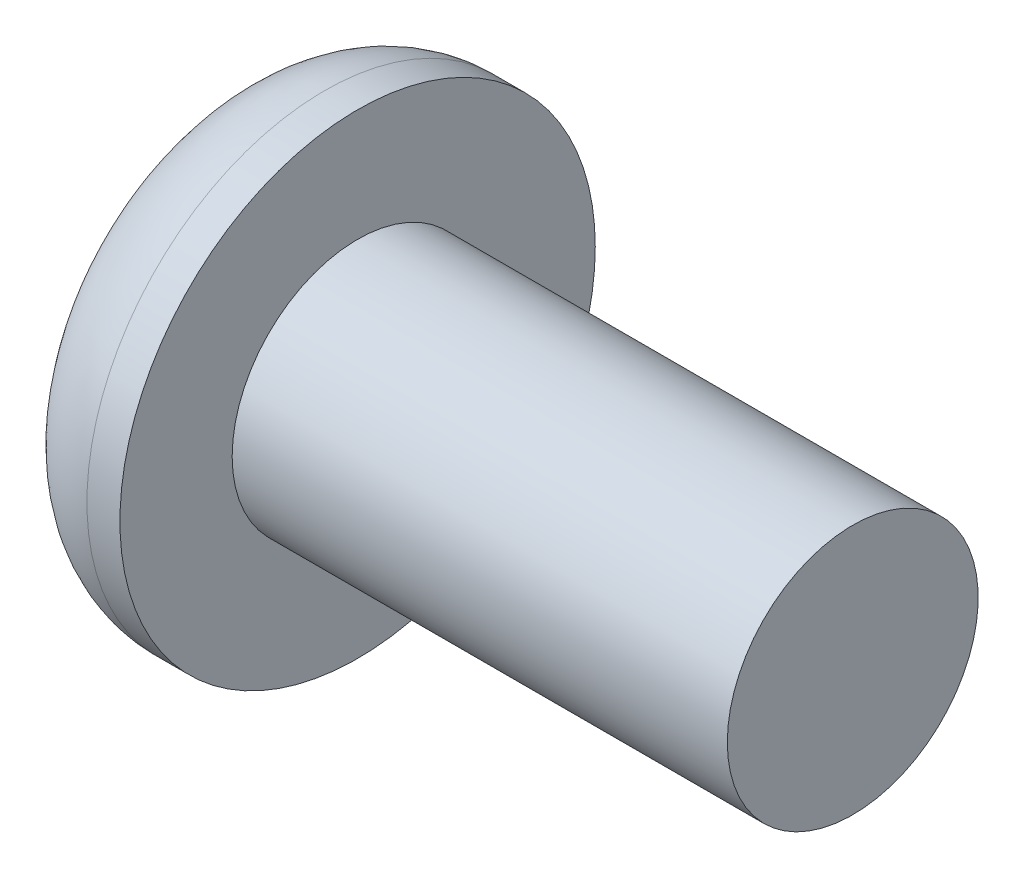
from build123d import *

# Parameters (mm, degrees)
SKETCH1_R           = 4.572
BOSS_EXTRUDE1_DEPTH = 2.54
SKETCH2_R           = 2.413
BOSS_EXTRUDE2_DEPTH = 9.525
FILLET1_R           = 1.905
CUT_EXTRUDE1_DEPTH  = 1.905


with BuildPart() as part:
    # Sketch1 → Boss-Extrude1 (new body)
    with BuildSketch(Plane(origin=(0, 0, 0), x_dir=(0, 0, -1), z_dir=(1, 0, 0))):
        Circle(SKETCH1_R)
    extrude(amount=BOSS_EXTRUDE1_DEPTH)

    # Sketch2 → Boss-Extrude2 (add)
    with BuildSketch(Plane(origin=(2.54, 0, 0), x_dir=(0, 0, -1), z_dir=(1, 0, 0))):
        with Locations(Location((0, 0, 0), (0, 0, 180))):
            Circle(SKETCH2_R)
    extrude(amount=BOSS_EXTRUDE2_DEPTH)

    # Fillet1
    fillet1_edges = [part.edges().sort_by_distance(p)[0] for p in [
        (0, 0, 4.572),
    ]]
    fillet(fillet1_edges, radius=FILLET1_R)

    # Sketch3 → Cut-Extrude1 (cut)
    with BuildSketch(Plane.ZY):
        Polygon((1.573613406, -0.940185716), (1.601031418, 0.892696328), (0.027418011, 1.832882044), (-1.573613406, 0.940185716), (-1.601031418, -0.892696328), (-0.027418011, -1.832882044), align=None)
    extrude(amount=-CUT_EXTRUDE1_DEPTH, mode=Mode.SUBTRACT)


solid = part.part
